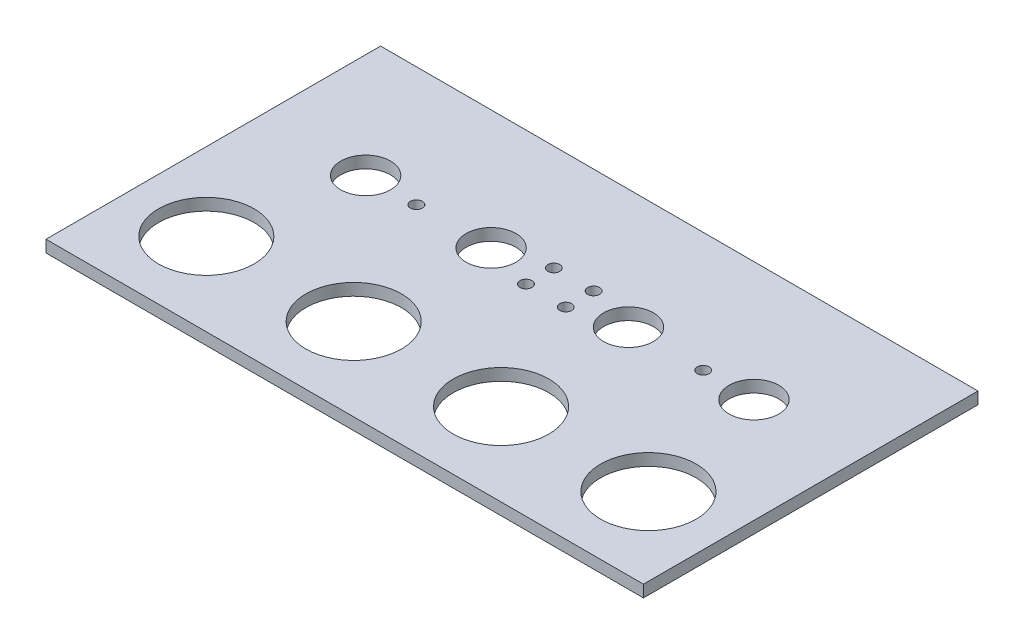
from build123d import *

# Parameters (mm, degrees)
SKETCH1_W           = 150
SKETCH1_H           = 84
SKETCH1_R           = 12
SKETCH1_R_2         = 6.25
SKETCH1_R_3         = 1.5
BOSS_EXTRUDE2_DEPTH = 3


with BuildPart() as part:
    # Sketch1 → Boss-Extrude2 (new body)
    with BuildSketch(Plane(origin=(0, 0, 0), x_dir=(1, 0, 0), z_dir=(0, 1, 0))):
        with Locations((14.43134335, 3.286639095)):
            Rectangle(SKETCH1_W, SKETCH1_H)
        with Locations(Location((-41.06865665, -17.963360905, 0), (0, 0, 270))):
            Circle(SKETCH1_R, mode=Mode.SUBTRACT)
        with Locations(Location((-4.06865665, -17.963360905, 0), (0, 0, 270))):
            Circle(SKETCH1_R, mode=Mode.SUBTRACT)
        with Locations(Location((-34.31865665, 15.286639095, 0), (0, 0, 270))):
            Circle(SKETCH1_R_2, mode=Mode.SUBTRACT)
        with Locations(Location((-21.56865665, 15.286639095, 0), (0, 0, 270))):
            Circle(SKETCH1_R_3, mode=Mode.SUBTRACT)
        with Locations(Location((-2.81865665, 15.286639095, 0), (0, 0, 270))):
            Circle(SKETCH1_R_2, mode=Mode.SUBTRACT)
        with Locations(Location((9.43134335, 18.786639095, 0), (0, 0, 270))):
            Circle(SKETCH1_R_3, mode=Mode.SUBTRACT)
        with Locations(Location((9.43134335, 11.786639095, 0), (0, 0, 270))):
            Circle(SKETCH1_R_3, mode=Mode.SUBTRACT)
        with Locations(Location((69.93134335, -17.963360905, 0), (0, 0, 90))):
            Circle(SKETCH1_R, mode=Mode.SUBTRACT)
        with Locations(Location((32.93134335, -17.963360905, 0), (0, 0, 90))):
            Circle(SKETCH1_R, mode=Mode.SUBTRACT)
        with Locations(Location((19.43134335, 11.786639095, 0), (0, 0, 90))):
            Circle(SKETCH1_R_3, mode=Mode.SUBTRACT)
        with Locations(Location((19.43134335, 18.786639095, 0), (0, 0, 90))):
            Circle(SKETCH1_R_3, mode=Mode.SUBTRACT)
        with Locations(Location((31.68134335, 15.286639095, 0), (0, 0, 90))):
            Circle(SKETCH1_R_2, mode=Mode.SUBTRACT)
        with Locations(Location((50.43134335, 15.286639095, 0), (0, 0, 90))):
            Circle(SKETCH1_R_3, mode=Mode.SUBTRACT)
        with Locations(Location((63.18134335, 15.286639095, 0), (0, 0, 90))):
            Circle(SKETCH1_R_2, mode=Mode.SUBTRACT)
    extrude(amount=-BOSS_EXTRUDE2_DEPTH)


solid = part.part
